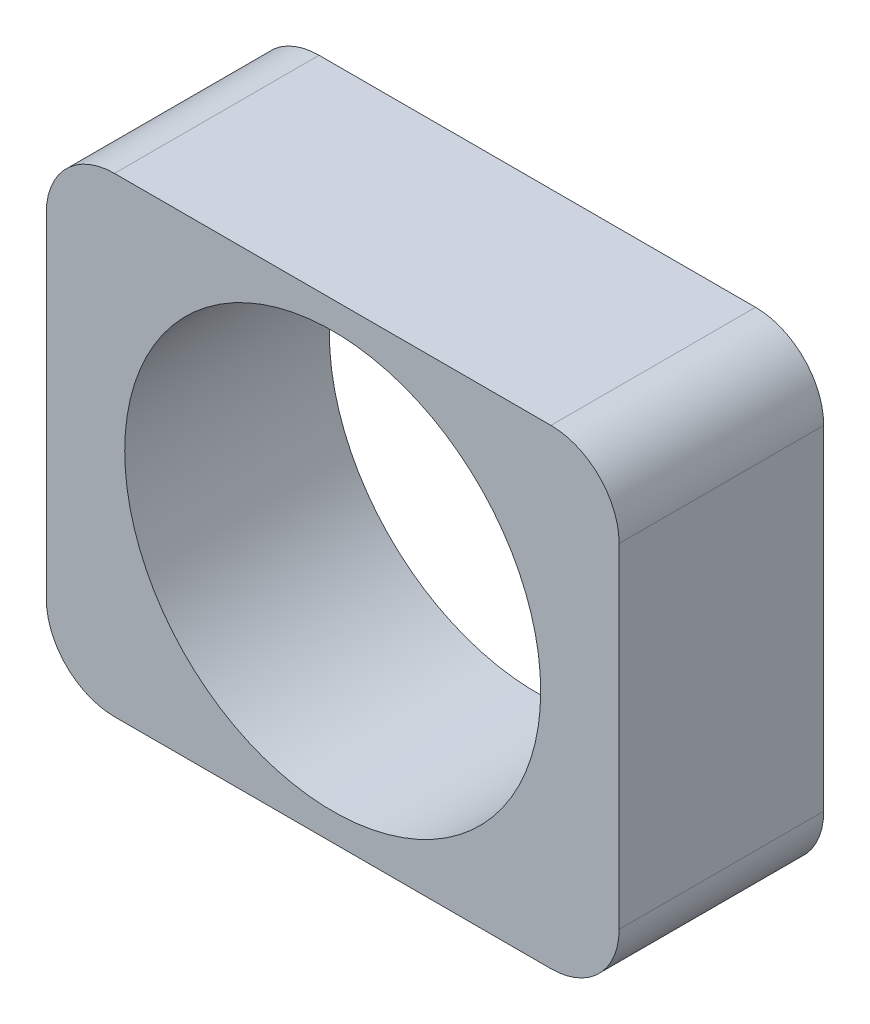
from build123d import *

# Parameters (mm, degrees)
SKETCH1_W           = 16.8
SKETCH1_H           = 13.8
BOSS_EXTRUDE1_DEPTH = 6
CUT_EXTRUDE1_REACH  = 14.417
SKETCH2_R           = 6.1
FILLET1_R           = 2


with BuildPart() as part:
    # Sketch1 → Boss-Extrude1 (new body)
    with BuildSketch(Plane.XY):
        Rectangle(SKETCH1_W, SKETCH1_H)
    extrude(amount=BOSS_EXTRUDE1_DEPTH)

    # Sketch2 → Cut-Extrude1 (cut, up to next)
    with BuildSketch(Plane.XY.offset(6), mode=Mode.PRIVATE) as cut_extrude1_sk1:
        Circle(SKETCH2_R)
    cut_extrude1_tool1 = extrude(cut_extrude1_sk1.sketch, amount=-CUT_EXTRUDE1_REACH, mode=Mode.PRIVATE) & part.part
    add(cut_extrude1_tool1.solids().sort_by_distance((0, 0, 6))[0], mode=Mode.SUBTRACT)

    # Fillet1
    fillet1_edges = [part.edges().sort_by_distance(p)[0] for p in [
        (8.4, -6.9, 3),
        (-8.4, -6.9, 3),
        (8.4, 6.9, 3),
        (-8.4, 6.9, 3),
    ]]
    fillet(fillet1_edges, radius=FILLET1_R)


solid = part.part
